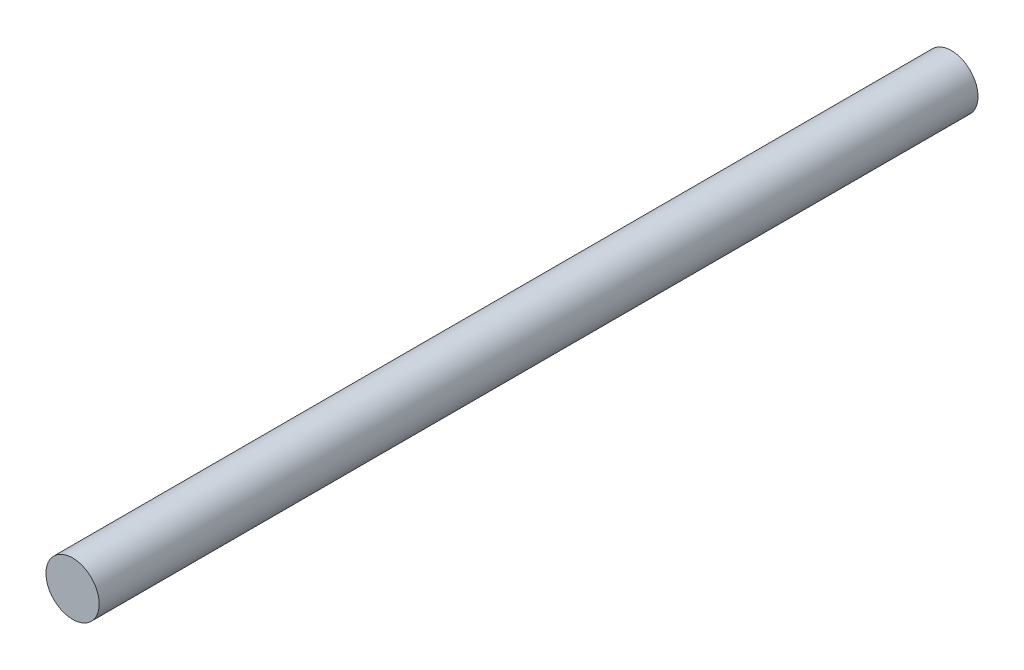
from build123d import *

# Parameters (mm, degrees)
SKETCH_1_R      = 10
EXTRUDE_1_DEPTH = 330


with BuildPart() as part:
    # 草图1 → 凸台-拉伸1 (new body)
    with BuildSketch(Plane.XY):
        Circle(SKETCH_1_R)
    extrude(amount=EXTRUDE_1_DEPTH)


solid = part.part
